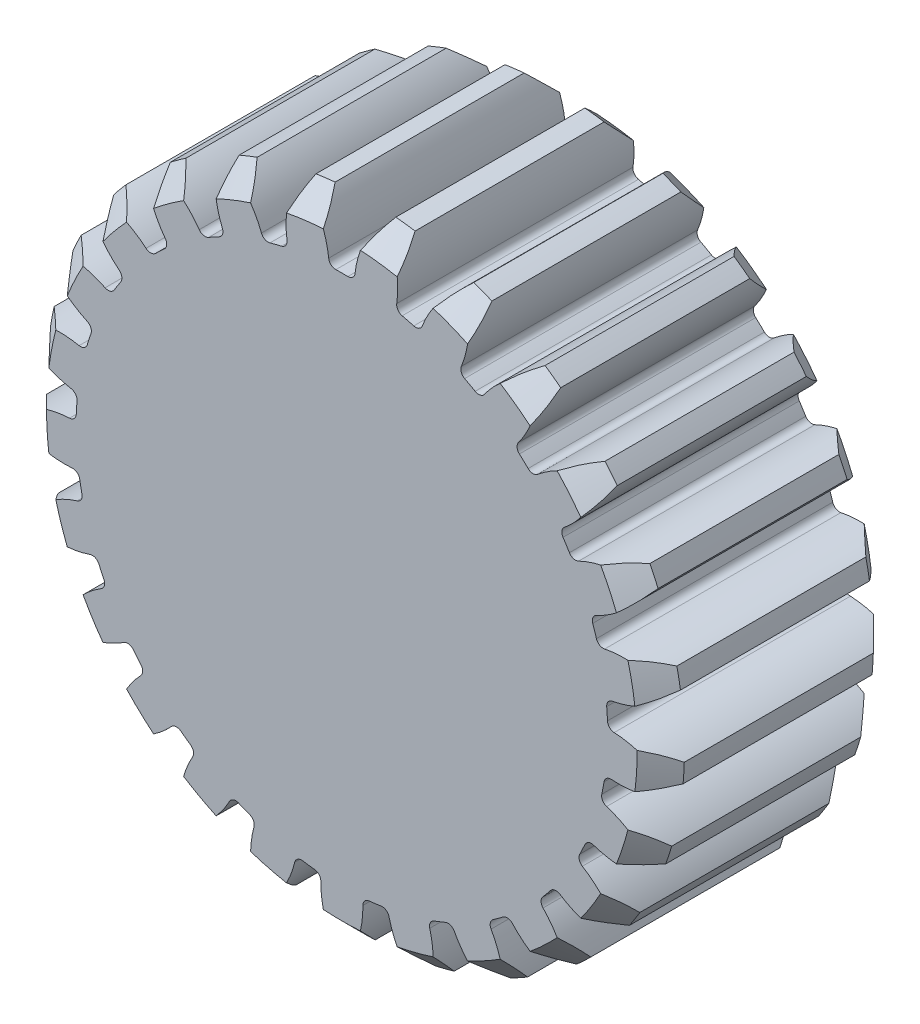
from build123d import *

# Parameters (mm, degrees)
SKETCH2_R                = 27
BOSS_EXTRUDE1_DEPTH      = 10
CUT_EXTRUDE1_DEPTH       = 40.471508712
FILLET1_R                = 0.6
CHAMFER1_SIZE            = 2
CIRPATTERN1_COUNT        = 25
FILLET1_OF_CIRPATTERN1_R = 0.6


with BuildPart() as part:
    # Sketch2 → Boss-Extrude1 (new, symmetric)
    with BuildSketch(Plane.XY):
        Circle(SKETCH2_R)
    extrude(amount=BOSS_EXTRUDE1_DEPTH, both=True)

    # Sketch3 → Cut-Extrude1 (cut, symmetric)
    with BuildSketch(Plane.XY):
        with BuildLine():
            ThreePointArc((-3.31531694, 27.803033532), (-1.721489921, 25.337524375), (-1.072022538, 22.474446994))
            ThreePointArc((-1.072022538, 22.474446994), (0, 22.5), (1.072022538, 22.474446994))
            ThreePointArc((1.072022538, 22.474446994), (1.721489921, 25.337524375), (3.31531694, 27.803033532))
            ThreePointArc((3.31531694, 27.803033532), (0, 28), (-3.31531694, 27.803033532))
        make_face()
    cut_extrude1 = extrude(amount=CUT_EXTRUDE1_DEPTH, both=True, mode=Mode.SUBTRACT)

    # Fillet1
    fillet1_edges = [part.edges().sort_by_distance(p)[0] for p in [
        (-1.072022538, 22.474446994, 0),
        (1.072022538, 22.474446994, 0),
    ]]
    fillet(fillet1_edges, radius=FILLET1_R)

    # Chamfer1
    chamfer1_edges = [part.edges().sort_by_distance(p)[0] for p in [
        (0, -27, -10),
        (0, -27, 10),
    ]]
    chamfer(chamfer1_edges, length=CHAMFER1_SIZE)

    # CirPattern1: Cut-Extrude1 ×25 about axis
    cirpattern1_axis = Axis((0, 0, 0), (0, 0, 1))
    for i in range(1, CIRPATTERN1_COUNT):
        add(cut_extrude1.rotate(cirpattern1_axis, i * 360 / CIRPATTERN1_COUNT), mode=Mode.SUBTRACT)

    # Fillet1 of CirPattern1
    fillet1_of_cirpattern1_edges = [part.edges().sort_by_distance(p)[0] for p in [
        (-6.627510666, 21.50176975, 0),
        (-4.550824708, 22.034972078, 0),
        (-11.766567924, 19.178057235, 0),
        (-9.887726902, 20.210958827, 0),
        (-16.166288445, 15.649316851, 0),
        (-14.603346849, 17.117016703, 0),
        (-19.550221608, 11.137272336, 0),
        (-18.401384806, 12.947549467, 0),
        (-21.705742446, 5.92543204, 0),
        (-21.043196081, 7.964540081, 0),
        (-22.497411659, 0.341275057, 0),
        (-22.362785954, 2.481089349, 0),
        (-21.875485757, -5.264325494, 0),
        (-22.277239742, -3.158257351, 0),
        (-19.879042632, -10.539149113, 0),
        (-20.791932626, -8.599159126, 0),
        (-16.63352615, -15.151759232, 0),
        (-18.000191916, -13.499744108, 0),
        (-12.342864045, -18.812328595, 0),
        (-14.077432948, -17.552090519, 0),
        (-7.276654398, -21.290850165, 0),
        (-9.270137095, -20.501574531, 0),
        (-1.753225794, -22.431589318, 0),
        (-3.880364434, -22.162869215, 0),
        (3.880364434, -22.162869215, 0),
        (1.753225794, -22.431589318, 0),
        (9.270137095, -20.501574531, 0),
        (7.276654398, -21.290850165, 0),
        (14.077432948, -17.552090519, 0),
        (12.342864045, -18.812328595, 0),
        (18.000191916, -13.499744108, 0),
        (16.63352615, -15.151759232, 0),
        (20.791932626, -8.599159126, 0),
        (19.879042632, -10.539149113, 0),
        (22.277239742, -3.158257351, 0),
        (21.875485757, -5.264325494, 0),
        (22.362785954, 2.481089349, 0),
        (22.497411659, 0.341275057, 0),
        (21.043196081, 7.964540081, 0),
        (21.705742446, 5.92543204, 0),
        (18.401384806, 12.947549467, 0),
        (19.550221608, 11.137272336, 0),
        (14.603346849, 17.117016703, 0),
        (16.166288445, 15.649316851, 0),
        (9.887726902, 20.210958827, 0),
        (11.766567924, 19.178057235, 0),
        (4.550824708, 22.034972078, 0),
        (6.627510666, 21.50176975, 0),
    ]]
    fillet(fillet1_of_cirpattern1_edges, radius=FILLET1_OF_CIRPATTERN1_R)


solid = part.part
